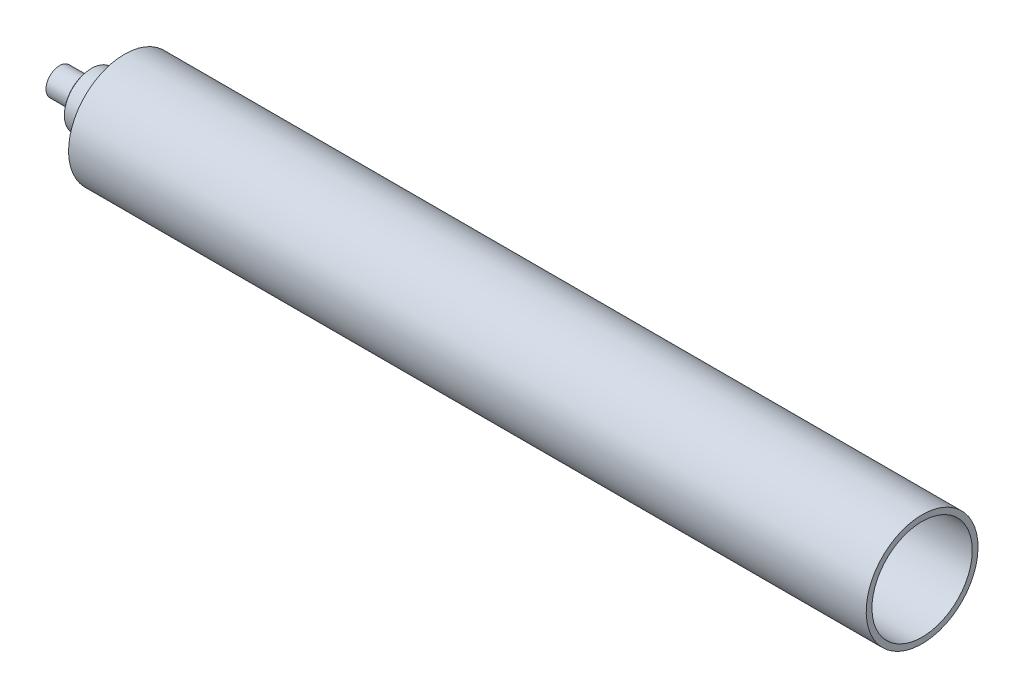
from build123d import *

# Parameters (mm, degrees)
SKETCH19_R         = 4
CUT_EXTRUDE3_DEPTH = 25.4


with BuildPart() as part:
    # Sketch1 → Revolve1 (revolve)
    with BuildSketch(Plane.XY):
        with BuildLine():
            Line((0, 0), (0, 11.938))
            Line((0, 11.938), (24.765, 11.938))
            ThreePointArc((24.765, 11.938), (26.561051224, 12.681948776), (27.305, 14.478))
            Line((27.305, 14.478), (27.305, 22.933028409))
            Line((27.305, 22.933028409), (28.104406531, 23.876))
            Line((28.104406531, 23.876), (57.15, 23.876))
            Line((57.15, 23.876), (57.15, 49.2125))
            Line((57.15, 49.2125), (759.206, 49.2125))
            Line((759.206, 49.2125), (759.206, 44.1325))
            Line((759.206, 44.1325), (62.23, 44.1325))
            Line((62.23, 44.1325), (62.23, 0))
            Line((62.23, 0), (0, 0))
        make_face()
    revolve(axis=Axis((62.23, 0, 0), (-1, 0, 0)))

    # Sketch16 → Cut-Revolve1 (revolve, cut)
    with BuildSketch(Plane(origin=(0, 0, 0), x_dir=(1, 0, 0), z_dir=(0, 1, 0))):
        Polygon((0, 0), (0, 8.35025), (1.905, 6.556375), (1.905, 0), align=None)
    revolve(axis=Axis((1.905, 0, 0), (-1, 0, 0)), mode=Mode.SUBTRACT)

    # Sketch19 → Cut-Extrude3 (cut)
    with BuildSketch(Plane.ZY.offset(-1.905)):
        Circle(SKETCH19_R)
    extrude(amount=-CUT_EXTRUDE3_DEPTH, mode=Mode.SUBTRACT)

    # Sketch32 → Cut-Revolve6 (revolve, cut)
    with BuildSketch(Plane(origin=(0, 0, 0), x_dir=(1, 0, 0), z_dir=(0, 1, 0)), mode=Mode.PRIVATE) as cut_revolve6_sk:
        Polygon((27.305, 0), (28.575, 0), (27.305, 6.351059428), align=None)
    revolve(cut_revolve6_sk.sketch.rotate(Axis((27.305, 0, 0), (1, 0, 0)), 180), axis=Axis((27.305, 0, 0), (1, 0, 0)), mode=Mode.SUBTRACT)


solid = part.part
